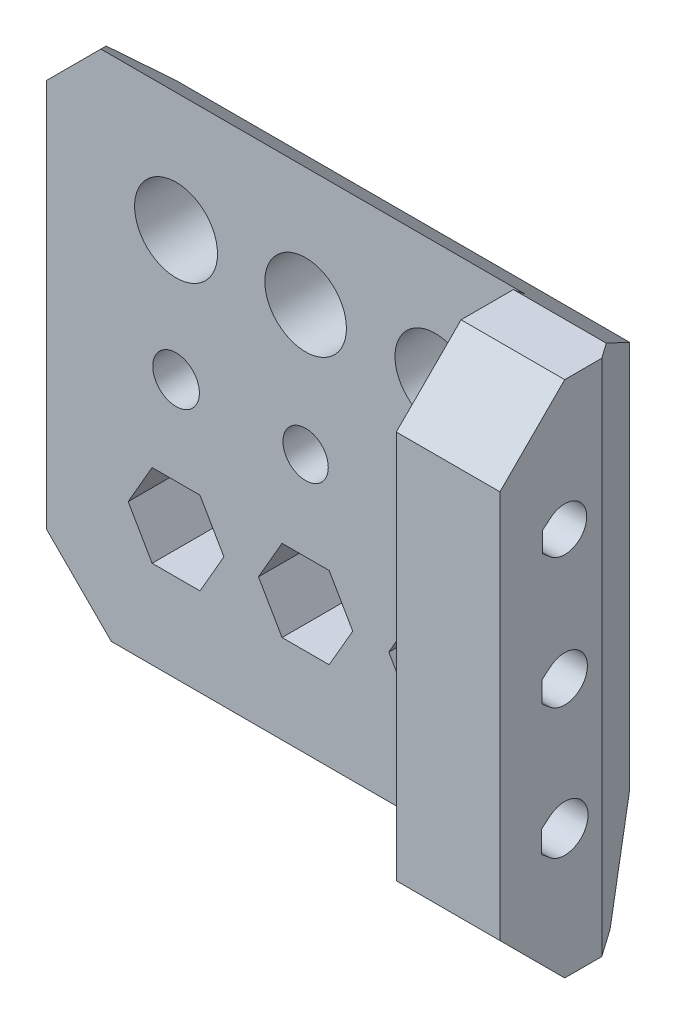
from build123d import *

# Parameters (mm, degrees)
SKETCH1_W           = 45
SKETCH1_H           = 40
SKETCH1_R           = 1.8
SKETCH1_R_2         = 1.75
SKETCH1_R_3         = 1.7
SKETCH1_R_4         = 3.2
SKETCH1_R_5         = 3.15
SKETCH1_R_6         = 3.1
BOSS_EXTRUDE1_DEPTH = 5
SKETCH2_W           = 8
SKETCH2_H           = 40
BOSS_EXTRUDE2_DEPTH = 10
CUT_EXTRUDE1_REACH  = 53.478
CHAMFER1_SIZE       = 5
CHAMFER2_SIZE       = 5
CHAMFER2_SIZE2      = 5.958767963
CHAMFER3_SIZE       = 5
CHAMFER4_SIZE       = 5
CHAMFER4_SIZE2      = 7.140740034
CHAMFER5_SIZE       = 5
CHAMFER5_SIZE2      = 4.195498156


with BuildPart() as part:
    # Sketch1 → Boss-Extrude1 (new body)
    with BuildSketch(Plane.XY):
        with Locations((-7.5, 0)):
            Rectangle(SKETCH1_W, SKETCH1_H)
        with Locations((-20, 0)):
            Circle(SKETCH1_R, mode=Mode.SUBTRACT)
        with Locations((-10, 0)):
            Circle(SKETCH1_R_2, mode=Mode.SUBTRACT)
        Circle(SKETCH1_R_3, mode=Mode.SUBTRACT)
        with Locations((-20, 10)):
            Circle(SKETCH1_R_4, mode=Mode.SUBTRACT)
        with Locations((-10, 10)):
            Circle(SKETCH1_R_5, mode=Mode.SUBTRACT)
        with Locations((0, 10)):
            Circle(SKETCH1_R_6, mode=Mode.SUBTRACT)
        Polygon((-16.304958277, -10), (-18.152479139, -6.8), (-21.847520861, -6.8), (-23.695041723, -10), (-21.847520861, -13.2), (-18.152479139, -13.2), align=None, mode=Mode.SUBTRACT)
        Polygon((-6.362693304, -10), (-8.181346652, -6.85), (-11.818653348, -6.85), (-13.637306696, -10), (-11.818653348, -13.15), (-8.181346652, -13.15), align=None, mode=Mode.SUBTRACT)
        Polygon((3.579571669, -10), (1.789785834, -6.9), (-1.789785834, -6.9), (-3.579571669, -10), (-1.789785834, -13.1), (1.789785834, -13.1), align=None, mode=Mode.SUBTRACT)
    extrude(amount=BOSS_EXTRUDE1_DEPTH)

    # Sketch2 → Boss-Extrude2 (add)
    with BuildSketch(Plane.XY.offset(5)):
        with Locations((11, 0)):
            Rectangle(SKETCH2_W, SKETCH2_H)
    extrude(amount=BOSS_EXTRUDE2_DEPTH)

    # Sketch3 → Cut-Extrude1 (cut, up to next)
    with BuildSketch(Plane(origin=(15, 0, 0), x_dir=(0, 0, -1), z_dir=(1, 0, 0)), mode=Mode.PRIVATE) as cut_extrude1_sk1:
        with BuildLine():
            Line((-11.092738936, 11.302275553), (-11.7, 10.792723019))
            Line((-11.7, 10.792723019), (-11.7, 9.207276981))
            Line((-11.7, 9.207276981), (-11.092738936, 8.697724447))
            ThreePointArc((-11.092738936, 8.697724447), (-8.3, 10), (-11.092738936, 11.302275553))
        make_face()
    cut_extrude1_tool1 = extrude(cut_extrude1_sk1.sketch, amount=-CUT_EXTRUDE1_REACH, mode=Mode.PRIVATE) & part.part
    # Sketch3 → Cut-Extrude1 (cut, up to next)
    with BuildSketch(Plane(origin=(15, 0, 0), x_dir=(0, 0, -1), z_dir=(1, 0, 0)), mode=Mode.PRIVATE) as cut_extrude1_sk2:
        with BuildLine():
            Line((-11.124878317, 1.340577775), (-11.75, 0.816038402))
            Line((-11.75, 0.816038402), (-11.75, -0.816038402))
            Line((-11.75, -0.816038402), (-11.124878317, -1.340577775))
            ThreePointArc((-11.124878317, -1.340577775), (-8.25, 0), (-11.124878317, 1.340577775))
        make_face()
    cut_extrude1_tool2 = extrude(cut_extrude1_sk2.sketch, amount=-CUT_EXTRUDE1_REACH, mode=Mode.PRIVATE) & part.part
    # Sketch3 → Cut-Extrude1 (cut, up to next)
    with BuildSketch(Plane(origin=(15, 0, 0), x_dir=(0, 0, -1), z_dir=(1, 0, 0)), mode=Mode.PRIVATE) as cut_extrude1_sk3:
        with BuildLine():
            Line((-11.157017697, -8.621120002), (-11.8, -9.160646215))
            Line((-11.8, -9.160646215), (-11.8, -10.839353785))
            Line((-11.8, -10.839353785), (-11.157017697, -11.378879998))
            ThreePointArc((-11.157017697, -11.378879998), (-8.2, -10), (-11.157017697, -8.621120002))
        make_face()
    cut_extrude1_tool3 = extrude(cut_extrude1_sk3.sketch, amount=-CUT_EXTRUDE1_REACH, mode=Mode.PRIVATE) & part.part
    add(cut_extrude1_tool1.solids().sort_by_distance((15, 10, 10.029483))[0], mode=Mode.SUBTRACT)
    add(cut_extrude1_tool2.solids().sort_by_distance((15, 0, 10.03035))[0], mode=Mode.SUBTRACT)
    add(cut_extrude1_tool3.solids().sort_by_distance((15, -10, 10.031217))[0], mode=Mode.SUBTRACT)

    # Chamfer1
    chamfer1_edges = [part.edges().sort_by_distance(p)[0] for p in [
        (-30, -20, 2.5),
        (-30, 20, 2.5),
        (11, -20, 15),
        (11, 20, 15),
    ]]
    chamfer(chamfer1_edges, length=CHAMFER1_SIZE)

    # Chamfer2
    chamfer2_edges = [part.edges().sort_by_distance(p)[0] for p in [
        (-5, 20, 0),
    ]]
    chamfer2_side = [part.faces().sort_by_distance(p)[0] for p in [
        (-6.76599085, 0.061969604, 0),
    ]]
    chamfer(chamfer2_edges, length=CHAMFER2_SIZE, length2=CHAMFER2_SIZE2, reference=chamfer2_side[0])

    # Chamfer3
    chamfer3_edges = [part.edges().sort_by_distance(p)[0] for p in [
        (-5, -20, 0),
    ]]
    chamfer(chamfer3_edges, length=CHAMFER3_SIZE)

    # Chamfer4
    chamfer4_edges = [part.edges().sort_by_distance(p)[0] for p in [
        (15, 0, 0),
    ]]
    chamfer4_side = [part.faces().sort_by_distance(p)[0] for p in [
        (-6.951751809, 0.085391734, 0),
    ]]
    chamfer(chamfer4_edges, length=CHAMFER4_SIZE, length2=CHAMFER4_SIZE2, reference=chamfer4_side[0])

    # Chamfer5
    chamfer5_edges = [part.edges().sort_by_distance(p)[0] for p in [
        (-30, 0, 0),
    ]]
    chamfer5_side = [part.faces().sort_by_distance(p)[0] for p in [
        (-10, -14.5, 0),
    ]]
    chamfer(chamfer5_edges, length=CHAMFER5_SIZE, length2=CHAMFER5_SIZE2, reference=chamfer5_side[0])


solid = part.part
